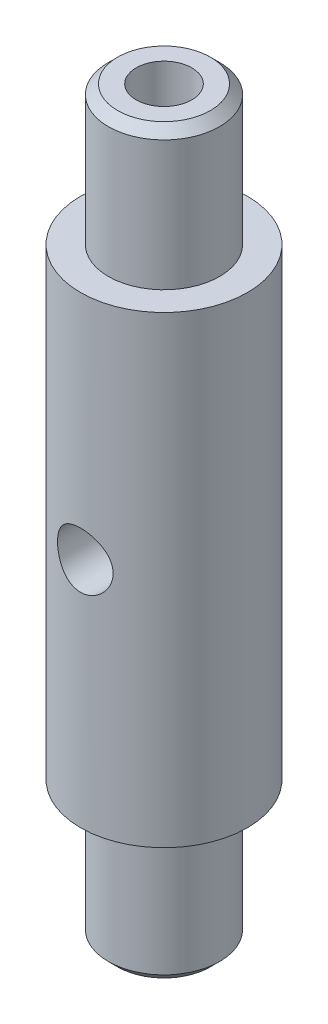
from build123d import *

# Parameters (mm, degrees)
SKETCH1_R           = 9
BOSS_EXTRUDE1_DEPTH = 25
SKETCH1_3_R         = 6
BOSS_EXTRUDE2_DEPTH = 40
CHAMFER1_SIZE       = 1
SKETCH2_R           = 3
CUT_EXTRUDE1_DEPTH  = 40
SKETCH3_R           = 3
CUT_EXTRUDE2_DEPTH  = 45


with BuildPart() as part:
    # Sketch1 → Boss-Extrude1 (new, symmetric)
    with BuildSketch(Plane(origin=(0, 0, 0), x_dir=(1, 0, 0), z_dir=(0, 1, 0))):
        Circle(SKETCH1_R)
    extrude(amount=BOSS_EXTRUDE1_DEPTH, both=True)

    # Sketch1<3> → Boss-Extrude2 (add, symmetric)
    with BuildSketch(Plane(origin=(0, 0, 0), x_dir=(1, 0, 0), z_dir=(0, 1, 0))):
        Circle(SKETCH1_3_R)
    extrude(amount=BOSS_EXTRUDE2_DEPTH, both=True)

    # Chamfer1
    chamfer1_edges = [part.edges().sort_by_distance(p)[0] for p in [
        (-6, -40, 0),
        (-6, 40, 0),
    ]]
    chamfer(chamfer1_edges, length=CHAMFER1_SIZE)

    # Sketch2 → Cut-Extrude1 (cut, symmetric)
    with BuildSketch(Plane.XY):
        Circle(SKETCH2_R)
    extrude(amount=CUT_EXTRUDE1_DEPTH, both=True, mode=Mode.SUBTRACT)

    # Sketch3 → Cut-Extrude2 (cut)
    with BuildSketch(Plane(origin=(0, 40, 0), x_dir=(1, 0, 0), z_dir=(0, 1, 0))):
        Circle(SKETCH3_R)
    extrude(amount=-CUT_EXTRUDE2_DEPTH, mode=Mode.SUBTRACT)

    # Cut-Extrude3 cone 1 section (through the dimple's axis) → Cut-Extrude3 (revolve, cut)
    with BuildSketch(Plane(origin=(0, -5, 0), x_dir=(0, 0, 1), z_dir=(1, 0, 0))):
        Polygon((0, 0), (3, 0), (0, 1.732050808), align=None)
    revolve(axis=Axis((0, -5, 0), (0, -1, 0)), mode=Mode.SUBTRACT)


solid = part.part
